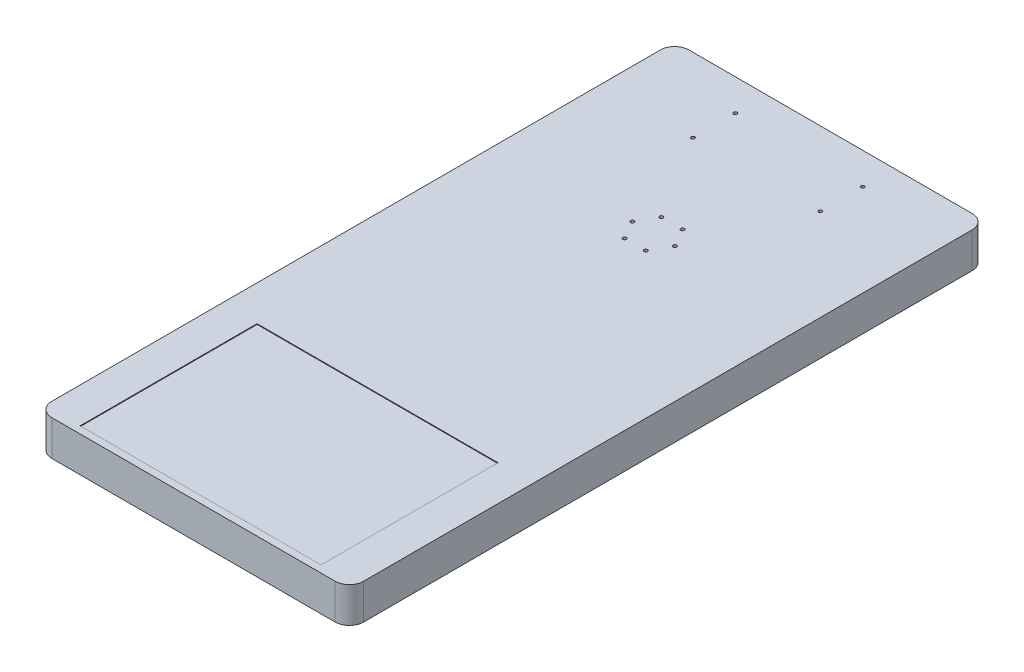
from build123d import *

# Parameters (mm, degrees)
SKETCH_1_W              = 340.4
SKETCH_1_H              = 900
EXTRUDE_1_DEPTH         = 50
HOLE_WIZARD_M6_3_D      = 5
HOLE_WIZARD_M6_3_DEPTH  = 20
HOLE_WIZARD_M6_3_TIP    = 1.502151548
CUT_EXTRUDE_1_DEPTH     = 1
HOLE_WIZARD_M6_4_D      = 5
HOLE_WIZARD_M6_4_DEPTH  = 15
HOLE_WIZARD_M6_4_TIP    = 1.502151548
HOLE_WIZARD_M6_9_D      = 5
HOLE_WIZARD_M6_9_DEPTH  = 12
HOLE_WIZARD_M6_9_TIP    = 1.502151548
SKETCH_32_W             = 50
SKETCH_32_H             = 900
EXTRUDE_2_DEPTH         = 50
HOLE_WIZARD_M8_2_D      = 6.8
HOLE_WIZARD_M8_2_DEPTH  = 19.75
HOLE_WIZARD_M8_2_TIP    = 2.042926105
FILLET_1_R              = 20
HOLE_WIZARD_M6_12_D     = 5
HOLE_WIZARD_M6_12_DEPTH = 15
HOLE_WIZARD_M6_12_TIP   = 1.502151548
M5_C_1_D                = 5.3
M5_C_1_DEPTH            = 5.2
M5_C_1_CBORE_D          = 11
M5_C_1_CBORE_DEPTH      = 0.5
M5_C_1_TIP              = 1.59228064


with BuildPart() as part:
    # 草图1 → 凸台-拉伸1 (new body)
    with BuildSketch(Plane(origin=(0, 0, 0), x_dir=(1, 0, 0), z_dir=(0, 1, 0))):
        Rectangle(SKETCH_1_W, SKETCH_1_H)
    extrude(amount=EXTRUDE_1_DEPTH)

    # M6 螺纹孔3
    with Locations(Plane(origin=(0, 50, 0), x_dir=(1, 0, 0), z_dir=(0, 1, 0))):
        with Locations((15, 225.980762114), (15, 174.019237886), (-15, 174.019237886), (-30, 200), (-15, 225.980762114), (30, 200)):
            Hole(HOLE_WIZARD_M6_3_D / 2, depth=HOLE_WIZARD_M6_3_DEPTH)
            with Locations((0, 0, -(HOLE_WIZARD_M6_3_DEPTH + HOLE_WIZARD_M6_3_TIP / 2))):  # 118° drill point
                Cone(0, HOLE_WIZARD_M6_3_D / 2, HOLE_WIZARD_M6_3_TIP, mode=Mode.SUBTRACT)

    # 草图16 → 切除-拉伸1 (cut)
    with BuildSketch(Plane(origin=(0, 50, 0), x_dir=(1, 0, 0), z_dir=(0, 1, 0))):
        Polygon((0, -440), (200, -440), (200, -190), (-200, -190), (-200, -440), align=None)
    extrude(amount=-CUT_EXTRUDE_1_DEPTH, mode=Mode.SUBTRACT)

    # M6 螺纹孔4
    with Locations(Plane.XZ):
        with Locations((0, 0), (105, 65), (-105, -65), (-105, 65), (105, -65)):
            Hole(HOLE_WIZARD_M6_4_D / 2, depth=HOLE_WIZARD_M6_4_DEPTH)
            with Locations((0, 0, -(HOLE_WIZARD_M6_4_DEPTH + HOLE_WIZARD_M6_4_TIP / 2))):  # 118° drill point
                Cone(0, HOLE_WIZARD_M6_4_D / 2, HOLE_WIZARD_M6_4_TIP, mode=Mode.SUBTRACT)

    # M6 螺纹孔9
    with Locations(Plane(origin=(0, 0, 0), x_dir=(-1, 0, 0), z_dir=(0, -1, 0))):
        with Locations((-63, -317.154485024), (63, -317.154485024), (63, -363.154485024), (-63, -363.154485024)):
            Hole(HOLE_WIZARD_M6_9_D / 2, depth=HOLE_WIZARD_M6_9_DEPTH)
            with Locations((0, 0, -(HOLE_WIZARD_M6_9_DEPTH + HOLE_WIZARD_M6_9_TIP / 2))):  # 118° drill point
                Cone(0, HOLE_WIZARD_M6_9_D / 2, HOLE_WIZARD_M6_9_TIP, mode=Mode.SUBTRACT)

    # 草图32 → 凸台-拉伸2 (add)
    with BuildSketch(Plane.XZ):
        with Locations((-195.2, 0)):
            Rectangle(SKETCH_32_W, SKETCH_32_H)
        with Locations((195.2, 0)):
            Rectangle(SKETCH_32_W, SKETCH_32_H)
    extrude(amount=-EXTRUDE_2_DEPTH)

    # M8 螺纹孔2
    with Locations(Plane(origin=(0, 0, 0), x_dir=(-1, 0, 0), z_dir=(0, -1, 0))):
        with Locations((-145, -304.975259132), (-145, -374.975259132), (145, -304.975259132), (145, -374.975259132)):
            Hole(HOLE_WIZARD_M8_2_D / 2, depth=HOLE_WIZARD_M8_2_DEPTH)
            with Locations((0, 0, -(HOLE_WIZARD_M8_2_DEPTH + HOLE_WIZARD_M8_2_TIP / 2))):  # 118° drill point
                Cone(0, HOLE_WIZARD_M8_2_D / 2, HOLE_WIZARD_M8_2_TIP, mode=Mode.SUBTRACT)

    # 圆角1
    fillet_1_edges = [part.edges().sort_by_distance(p)[0] for p in [
        (220.2, 25, -450),
        (-220.2, 25, -450),
        (-220.2, 25, 450),
        (220.2, 25, 450),
    ]]
    fillet(fillet_1_edges, radius=FILLET_1_R)

    # M6 螺纹孔12
    with Locations(Plane(origin=(0, 50, 0), x_dir=(1, 0, 0), z_dir=(0, 1, 0))):
        with Locations((-89.854599393, 405.43620182), (-89.854599393, 345.43620182), (90.145400607, 345.43620182), (90.145400607, 405.43620182)):
            Hole(HOLE_WIZARD_M6_12_D / 2, depth=HOLE_WIZARD_M6_12_DEPTH)
            with Locations((0, 0, -(HOLE_WIZARD_M6_12_DEPTH + HOLE_WIZARD_M6_12_TIP / 2))):  # 118° drill point
                Cone(0, HOLE_WIZARD_M6_12_D / 2, HOLE_WIZARD_M6_12_TIP, mode=Mode.SUBTRACT)

    # M5 六角头螺栓C级的柱形沉头孔1
    with Locations(Plane(origin=(0, 0, 0), x_dir=(-1, 0, 0), z_dir=(0, -1, 0))):
        with Locations((-37.5, 221.64), (37.5, 221.64), (-37.5, 136.64), (37.5, 136.64)):
            CounterBoreHole(M5_C_1_D / 2, M5_C_1_CBORE_D / 2, M5_C_1_CBORE_DEPTH, depth=M5_C_1_DEPTH)
            with Locations((0, 0, -(M5_C_1_DEPTH + M5_C_1_TIP / 2))):  # 118° drill point
                Cone(0, M5_C_1_D / 2, M5_C_1_TIP, mode=Mode.SUBTRACT)


solid = part.part
